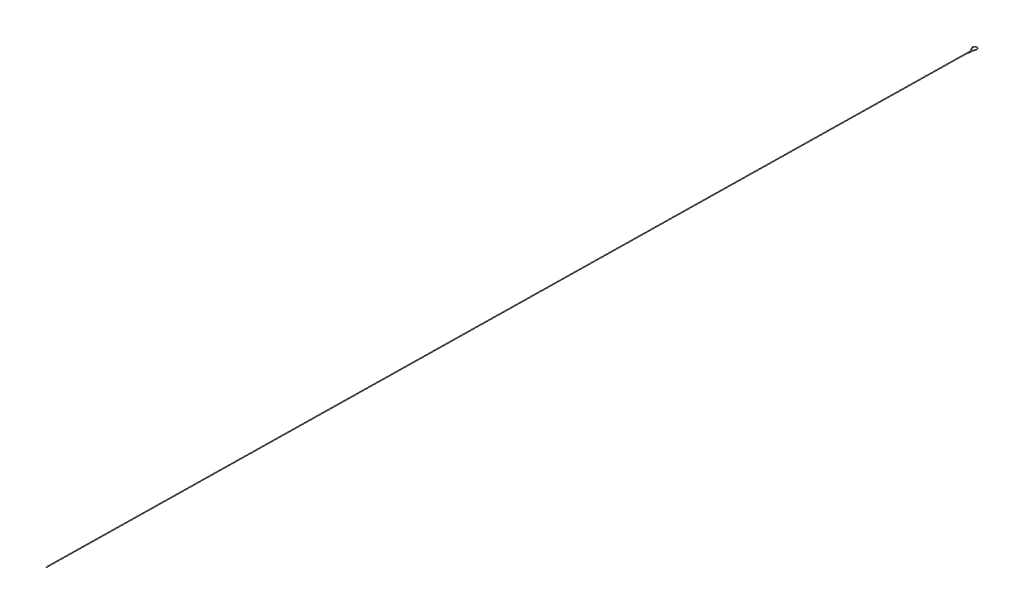
from build123d import *

# Parameters (mm, degrees)
SKETCH7_R = 1.575


with BuildPart() as part:
    # Sweep5: sweep along a path in Sketch1
    with BuildLine(Plane(origin=(0, 0, 0), x_dir=(1, 0, 0), z_dir=(0, 1, 0))) as sweep5_path:
        Line((3.2, 4558.797390764), (3.2, 4570.940760898))
        Line((3.2, 4570.940760898), (3.422323637, 4578.593779589))
        ThreePointArc((3.422323637, 4578.593779589), (3.720004436, 4580.742006463), (4.473834752, 4582.77553355))
        Line((4.473834752, 4582.77553355), (7.617815914, 4589.063495874))
        ThreePointArc((7.617815914, 4589.063495874), (6.68100213, 4599.525674764), (-3.090825138, 4603.37875133))
        ThreePointArc((-3.090825138, 4603.37875133), (-4.028782044, 4603.17375428), (-4.948572359, 4602.898485821))
        ThreePointArc((-4.948572359, 4602.898485821), (-11.049300502, 4597.037756376), (-10.474334218, 4588.597587701))
        Line((-10.474334218, 4588.597587701), (-1.247075911, 4571.896494591))
        ThreePointArc((-1.247075911, 4571.896494591), (-0.316786668, 4569.557628354), (0, 4567.060554155))
        Line((0, 4567.060554155), (0, 4558.797390764))
        Line((0, 4558.797390764), (-76.2, 0))
        Line((-76.2, 0), (-76.2, -10))
    # Sketch7 → Sweep5 (sweep)
    with BuildSketch(Plane.XY.offset(10)):
        with Locations((-76.2, 0)):
            Circle(SKETCH7_R)
    sweep(path=sweep5_path.line, transition=Transition.RIGHT)


solid = part.part
